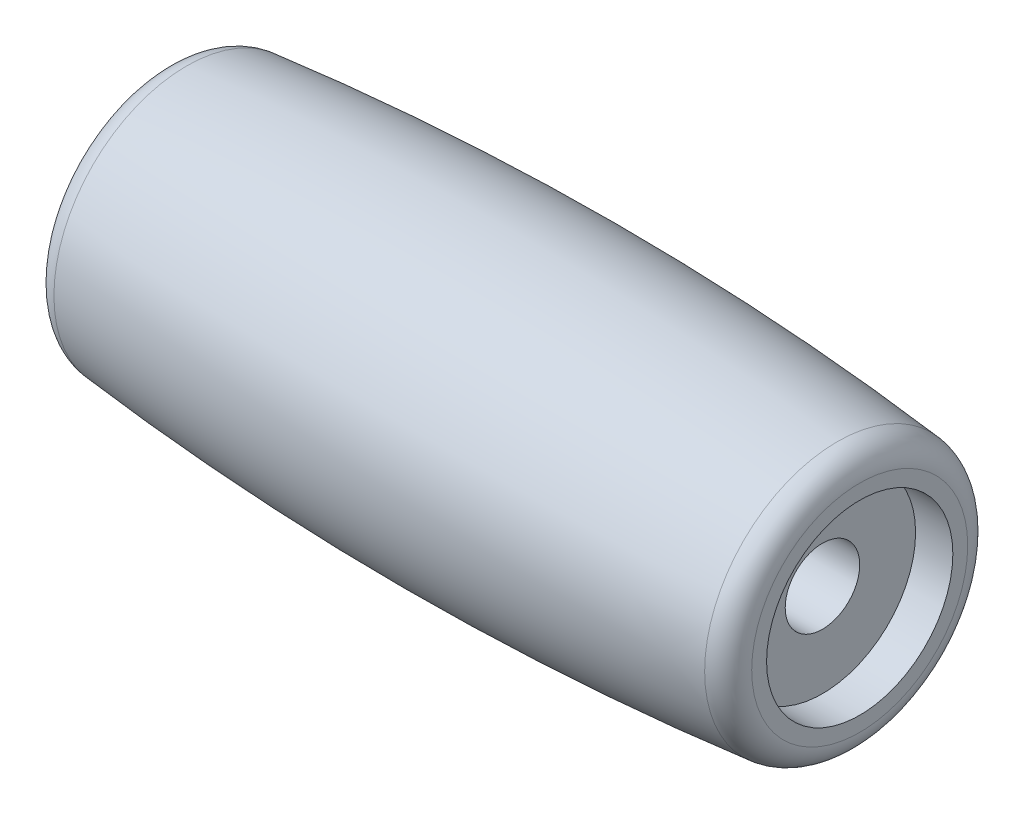
from build123d import *


with BuildPart() as part:
    # Sketch1 → Revolve2 (revolve)
    with BuildSketch(Plane(origin=(0, 0, 0), x_dir=(1, 0, 0), z_dir=(0, 1, 0)), mode=Mode.PRIVATE) as revolve2_sk:
        with BuildLine():
            Line((49.060651753, 16.24649425), (49.060651753, 13.99649425))
            Line((49.060651753, 13.99649425), (24.060651753, 13.99649425))
            Line((24.060651753, 13.99649425), (24.060651753, 16.24649425))
            Line((24.060651753, 16.24649425), (22.560651753, 16.24649425))
            Line((22.560651753, 16.24649425), (22.560651753, 16.845070915))
            ThreePointArc((22.560651753, 16.845070915), (22.819042706, 17.515903249), (23.460683794, 17.840061571))
            ThreePointArc((23.460683794, 17.840061571), (36.560651753, 18.49649425), (49.660619712, 17.840061571))
            ThreePointArc((49.660619712, 17.840061571), (50.302260801, 17.515903249), (50.560651753, 16.845070915))
            Line((50.560651753, 16.845070915), (50.560651753, 16.24649425))
            Line((50.560651753, 16.24649425), (49.060651753, 16.24649425))
        make_face()
    revolve(revolve2_sk.sketch.rotate(Axis((22.560651753, 0, -12.49649425), (1, 0, 0)), 180), axis=Axis((22.560651753, 0, -12.49649425), (1, 0, 0)))


solid = part.part
